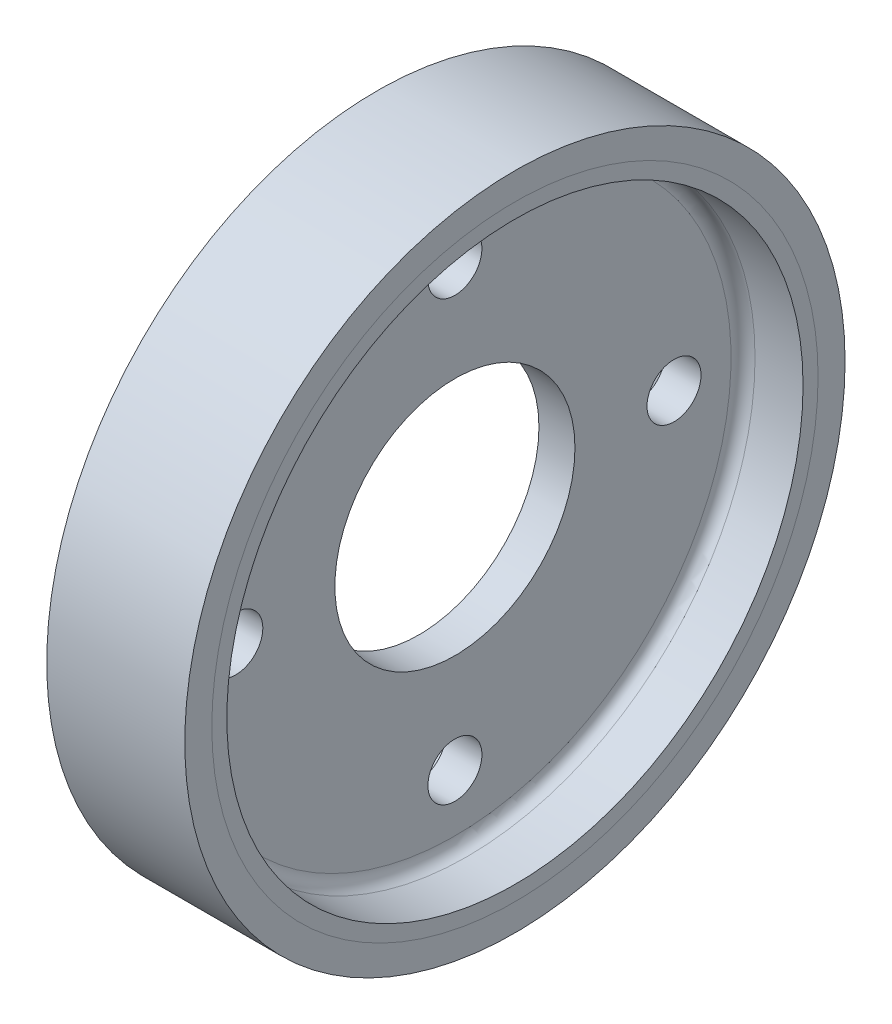
from build123d import *

# Parameters (mm, degrees)
SKETCH1_W         = 23
SKETCH1_H         = 50.5
SKETCH2_W         = 23
SKETCH2_H         = 4.5
SKETCH5_W         = 4.5
SKETCH5_H         = 16
CIRPATTERN1_COUNT = 4
FILLET1_R         = 2
CHAMFER2_SIZE     = 1


with BuildPart() as part:
    # Sketch1 → Revolve1 (revolve)
    with BuildSketch(Plane.XY, mode=Mode.PRIVATE) as revolve1_sk:
        with Locations((-11.5, 25.25)):
            Rectangle(SKETCH1_W, SKETCH1_H)
    revolve(revolve1_sk.sketch.rotate(Axis((0, 0, 0), (-1, 0, 0)), 90), axis=Axis((0, 0, 0), (-1, 0, 0)))

    # Sketch3 → Cut-Revolve1 (revolve, cut)
    with BuildSketch(Plane.XY, mode=Mode.PRIVATE) as cut_revolve1_sk:
        Polygon((0, 48), (-10, 48), (-10, 20), (-16, 20), (-16, 44), (-23, 44), (-23, 0), (0, 0), align=None)
    revolve(cut_revolve1_sk.sketch.rotate(Axis((0, 0, 0), (-1, 0, 0)), 90), axis=Axis((0, 0, 0), (-1, 0, 0)), mode=Mode.SUBTRACT)

    # Sketch5 → Ø9.0 (9) Diameter Hole1 (revolve, cut)
    with BuildSketch(Plane(origin=(-16, 36.5, 0), x_dir=(0, 0, 1), z_dir=(0, 1, 0))):
        with Locations((2.25, 8)):
            Rectangle(SKETCH5_W, SKETCH5_H)
    f_9_0_9_diameter_hole1 = revolve(axis=Axis((-22.35, 36.5, 0), (1, 0, 0)), mode=Mode.SUBTRACT)

    # CirPattern1: Ø9.0 (9) Diameter Hole1 ×4 about axis
    cirpattern1_axis = Axis((0, 0, 0), (1, 0, 0))
    for i in range(1, CIRPATTERN1_COUNT):
        add(f_9_0_9_diameter_hole1.rotate(cirpattern1_axis, i * 360 / CIRPATTERN1_COUNT), mode=Mode.SUBTRACT)

    # Fillet1
    fillet1_edges = [part.edges().sort_by_distance(p)[0] for p in [
        (-10, 0, 48),
    ]]
    fillet(fillet1_edges, radius=FILLET1_R)

    # Chamfer2
    chamfer2_edges = [part.edges().sort_by_distance(p)[0] for p in [
        (-23, 0, 44),
    ]]
    chamfer(chamfer2_edges, length=CHAMFER2_SIZE)


with BuildPart() as body_2:
    # Sketch2 → Revolve2 (revolve)
    with BuildSketch(Plane.XY, mode=Mode.PRIVATE) as revolve2_sk:
        with Locations((-11.5, 52.75)):
            Rectangle(SKETCH2_W, SKETCH2_H)
    revolve(revolve2_sk.sketch.rotate(Axis((0, 0, 0), (-1, 0, 0)), 90), axis=Axis((0, 0, 0), (-1, 0, 0)))


solid = Compound([part.part, body_2.part])
